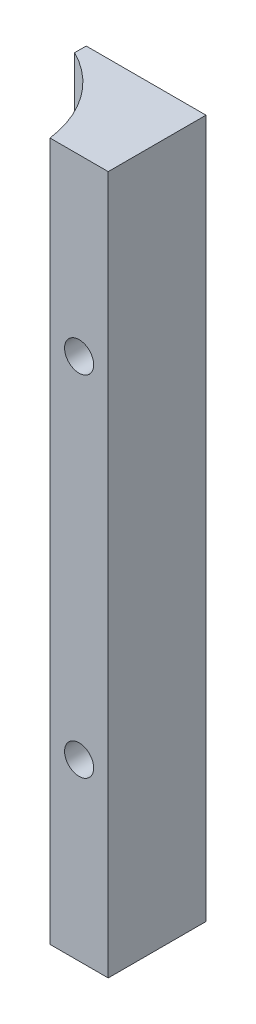
from build123d import *

# Parameters (mm, degrees)
BOSS_EXTRUDE1_DEPTH   = 60
F_2_5MM_DOWEL_HOLE1_D = 2.5


with BuildPart() as part:
    # Sketch1 → Boss-Extrude1 (new body)
    with BuildSketch(Plane(origin=(0, 0, 0), x_dir=(1, 0, 0), z_dir=(0, 1, 0))):
        with BuildLine():
            Line((0, 0), (0, 8.4))
            Line((0, 8.4), (-10.290849044, 8.4))
            Line((-10.290849044, 8.4), (-10.290849044, 7.4))
            ThreePointArc((-10.290849044, 7.4), (-6.718748073, 4.362554757), (-5, 0))
            Line((-5, 0), (0, 0))
        make_face()
    extrude(amount=BOSS_EXTRUDE1_DEPTH)

    # Ø2.5mm Dowel Hole1 (through all)
    with Locations(Plane(origin=(-2.5, 45, 0), x_dir=(1, 0, 0), z_dir=(0, 0, 1))):
        with Locations((0, 0), (0, -30)):
            Hole(F_2_5MM_DOWEL_HOLE1_D / 2)


solid = part.part
